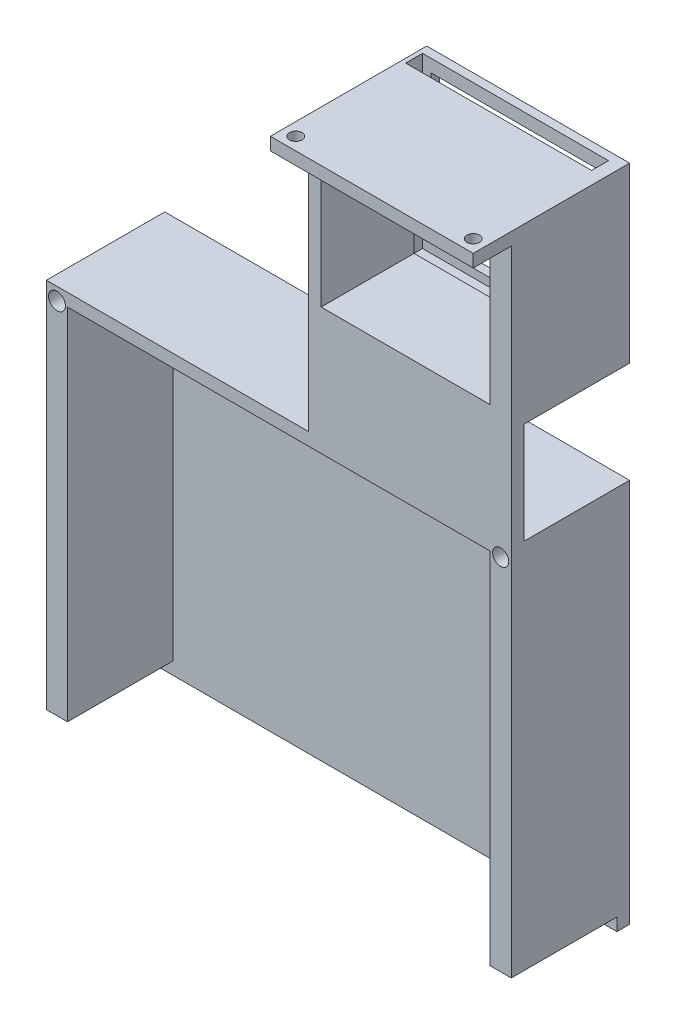
from build123d import *

# Parameters (mm, degrees)
SKICA1_W                      = 40
SKICA1_H                      = 85
SKICA1_H_2                    = 35
SKICA1_H_3                    = 30
P_IDAT_VYSUNUT_M1_DEPTH       = 3
SKICA3_W                      = 46
SKICA3_H                      = 156
SKICA3_W_2                    = 40
SKICA3_H_2                    = 150
VYSUNOUT_TENKOST_NN_1_DEPTH   = 28
ODEBRAT_VYSUNUT_M2_DEPTH      = 22
ODEBRAT_VYSUNUT_M2_DEPTH_BACK = 17
SKICA4_W                      = 40
SKICA4_H                      = 24
SKICA4_W_2                    = 6.963710183
SKICA4_W_3                    = 3
SKICA5_W                      = 43
SKICA5_H                      = 3
SKICA5_W_2                    = 40
P_IDAT_VYSUNUT_M2_DEPTH       = 25
SKICA6_W                      = 40
SKICA6_H                      = 24
P_IDAT_VYSUNUT_M3_DEPTH       = 3
SKICA7_W                      = 40
SKICA7_H                      = 35
ODEBRAT_VYSUNUT_M3_DEPTH      = 161.881944295
SKICA8_W                      = 44
SKICA8_H                      = 4
ODEBRAT_VYSUNUT_M4_DEPTH      = 40
SKICA13_W                     = 60
SKICA13_H                     = 85
P_IDAT_VYSUNUT_M7_DEPTH       = 3
SKICA14_W                     = 63
SKICA14_H                     = 91
SKICA14_W_2                   = 57
SKICA14_H_2                   = 85
P_IDAT_VYSUNUT_M8_DEPTH       = 28
SKICA15_W                     = 3
SKICA15_H                     = 85
ODEBRAT_VYSUNUT_M6_DEPTH      = 25
SKICA16_W                     = 46
SKICA16_H                     = 3
P_IDAT_VYSUNUT_M9_DEPTH       = 9
SKICA17_W                     = 110
SKICA17_H                     = 3
ODEBRAT_VYSUNUT_M7_DEPTH      = 34
SKICA21_W                     = 3
SKICA21_H                     = 3
P_IDAT_VYSUNUT_M10_DEPTH      = 2
P_IDAT_VYSUNUT_M11_DEPTH      = 2
SKICA23_R                     = 2
ODEBRAT_VYSUNUT_M10_DEPTH     = 5
ODEBRAT_VYSUNUT_M8_DEPTH      = 173.386194343
ODEBRAT_VYSUNUT_M8_DEPTH_BACK = 173.386194343
SKICA19_R                     = 1.5
SKICA24_R                     = 2
SKICA24_R_2                   = 1.910403137
ODEBRAT_VYSUNUT_M11_DEPTH     = 5


with BuildPart() as part:
    # Skica1 → Přidat vysunutím1 (new body)
    with BuildSketch(Plane.XY):
        with Locations((20, 42.5)):
            Rectangle(SKICA1_W, SKICA1_H)
        with Locations((20, 102.5)):
            Rectangle(SKICA1_W, SKICA1_H_2)
        with Locations((20, 135)):
            Rectangle(SKICA1_W, SKICA1_H_3)
    extrude(amount=-P_IDAT_VYSUNUT_M1_DEPTH)

    # Skica3 → Vysunout tenkostěnný1 (add)
    with BuildSketch(Plane(origin=(0, 0, -3), x_dir=(-1, 0, 0), z_dir=(0, 0, -1))):
        with Locations((-20, 75)):
            Rectangle(SKICA3_W, SKICA3_H)
        with Locations((-20, 75)):
            Rectangle(SKICA3_W_2, SKICA3_H_2, mode=Mode.SUBTRACT)
    extrude(amount=-VYSUNOUT_TENKOST_NN_1_DEPTH)

    # Skica4 → Odebrat vysunutím2 (cut, two sides: drawn at the far end of the back side and taken through both)
    with BuildSketch(Plane.XY.offset(-ODEBRAT_VYSUNUT_M2_DEPTH_BACK)):
        with Locations((20, 100)):
            Rectangle(SKICA4_W, SKICA4_H)
        with Locations((-3.481855092, 100)):
            Rectangle(SKICA4_W_2, SKICA4_H)
        with Locations((41.5, 100)):
            Rectangle(SKICA4_W_3, SKICA4_H)
    extrude(amount=ODEBRAT_VYSUNUT_M2_DEPTH + ODEBRAT_VYSUNUT_M2_DEPTH_BACK, mode=Mode.SUBTRACT)

    # Skica5 → Přidat vysunutím2 (add)
    with BuildSketch(Plane.XY):
        with Locations((21.5, 113.5)):
            Rectangle(SKICA5_W, SKICA5_H)
        with Locations((20, 86.5)):
            Rectangle(SKICA5_W_2, SKICA5_H)
    extrude(amount=P_IDAT_VYSUNUT_M2_DEPTH)

    # Skica6 → Přidat vysunutím3 (add)
    with BuildSketch(Plane.XY.offset(25)):
        with Locations((20, 100)):
            Rectangle(SKICA6_W, SKICA6_H)
    extrude(amount=-P_IDAT_VYSUNUT_M3_DEPTH)

    # Skica7 → Odebrat vysunutím3 (cut, through all)
    with BuildSketch(Plane.XY):
        with Locations((20, 132.5)):
            Rectangle(SKICA7_W, SKICA7_H)
    extrude(amount=-ODEBRAT_VYSUNUT_M3_DEPTH, mode=Mode.SUBTRACT)

    # Skica8 → Odebrat vysunutím4 (cut)
    with BuildSketch(Plane(origin=(0, 153, 0), x_dir=(1, 0, 0), z_dir=(0, 1, 0))):
        with Locations((20, -1)):
            Rectangle(SKICA8_W, SKICA8_H)
    extrude(amount=-ODEBRAT_VYSUNUT_M4_DEPTH, mode=Mode.SUBTRACT)

    # Skica13 → Přidat vysunutím7 (add)
    with BuildSketch(Plane(origin=(0, 0, -3), x_dir=(-1, 0, 0), z_dir=(0, 0, -1))):
        with Locations((30, 42.5)):
            Rectangle(SKICA13_W, SKICA13_H)
    extrude(amount=-P_IDAT_VYSUNUT_M7_DEPTH)

    # Skica14 → Přidat vysunutím8 (add)
    with BuildSketch(Plane(origin=(0, 0, -3), x_dir=(-1, 0, 0), z_dir=(0, 0, -1))):
        with Locations((31.5, 42.5)):
            Rectangle(SKICA14_W, SKICA14_H)
        with Locations((31.5, 42.5)):
            Rectangle(SKICA14_W_2, SKICA14_H_2, mode=Mode.SUBTRACT)
    extrude(amount=-P_IDAT_VYSUNUT_M8_DEPTH)

    # Skica15 → Odebrat vysunutím6 (cut)
    with BuildSketch(Plane.XY.offset(25)):
        with Locations((-1.5, 42.5)):
            Rectangle(SKICA15_W, SKICA15_H)
    extrude(amount=-ODEBRAT_VYSUNUT_M6_DEPTH, mode=Mode.SUBTRACT)

    # Skica16 → Přidat vysunutím9 (add)
    with BuildSketch(Plane.XY.offset(25)):
        with Locations((20, 151.5)):
            Rectangle(SKICA16_W, SKICA16_H)
    extrude(amount=P_IDAT_VYSUNUT_M9_DEPTH)

    # Skica17 → Odebrat vysunutím7 (cut)
    with BuildSketch(Plane.XY.offset(34)):
        with Locations((-10, -1.5)):
            Rectangle(SKICA17_W, SKICA17_H)
    extrude(amount=-ODEBRAT_VYSUNUT_M7_DEPTH, mode=Mode.SUBTRACT)

    # Skica21 → Přidat vysunutím10 (add)
    with BuildSketch(Plane.ZY.offset(63)):
        Polygon((25, 0), (25, 88), (-3, 88), (-3, 0), (0, 0), align=None)
        with Locations((-1.5, -1.5)):
            Rectangle(SKICA21_W, SKICA21_H)
    extrude(amount=P_IDAT_VYSUNUT_M10_DEPTH)

    # Skica22 → Přidat vysunutím11 (add)
    with BuildSketch(Plane(origin=(43, 0, 0), x_dir=(0, 0, -1), z_dir=(1, 0, 0))):
        Polygon((-25, 0), (0, 0), (0, -3), (3, -3), (3, 0), (3, 88), (-22, 88), (-22, 112), (3, 112), (3, 153), (-25, 153), (-34, 153), (-34, 150), (-25, 150), (-25, 112), (-25, 88), align=None)
    extrude(amount=P_IDAT_VYSUNUT_M11_DEPTH)

    # Skica23 → Odebrat vysunutím10 (cut)
    with BuildSketch(Plane.XZ):
        with Locations((42.5, 22.5)):
            Circle(SKICA23_R)
        with Locations((42.5, 2.5)):
            Circle(SKICA23_R)
        with Locations((-62.5, 2.5)):
            Circle(SKICA23_R)
        with Locations((-62.5, 22.5)):
            Circle(SKICA23_R)
    extrude(amount=-ODEBRAT_VYSUNUT_M10_DEPTH, mode=Mode.SUBTRACT)

    # Skica19 → Odebrat vysunutím8 (cut, two sides: drawn at the far end of the back side and taken through both)
    with BuildSketch(Plane(origin=(0, 153, 0), x_dir=(1, 0, 0), z_dir=(0, 1, 0)).offset(-ODEBRAT_VYSUNUT_M8_DEPTH_BACK)):
        with Locations(Location((42, -31, 0), (0, 0, 270))):
            Circle(SKICA19_R)
        with Locations(Location((0, -31, 0), (0, 0, 270))):
            Circle(SKICA19_R)
    extrude(amount=ODEBRAT_VYSUNUT_M8_DEPTH + ODEBRAT_VYSUNUT_M8_DEPTH_BACK, mode=Mode.SUBTRACT)

    # Skica24 → Odebrat vysunutím11 (cut)
    with BuildSketch(Plane.XY.offset(25)):
        with Locations((-62.5, 85)):
            Circle(SKICA24_R)
        with Locations((42.5, 85)):
            Circle(SKICA24_R_2)
    extrude(amount=-ODEBRAT_VYSUNUT_M11_DEPTH, mode=Mode.SUBTRACT)


solid = part.part
